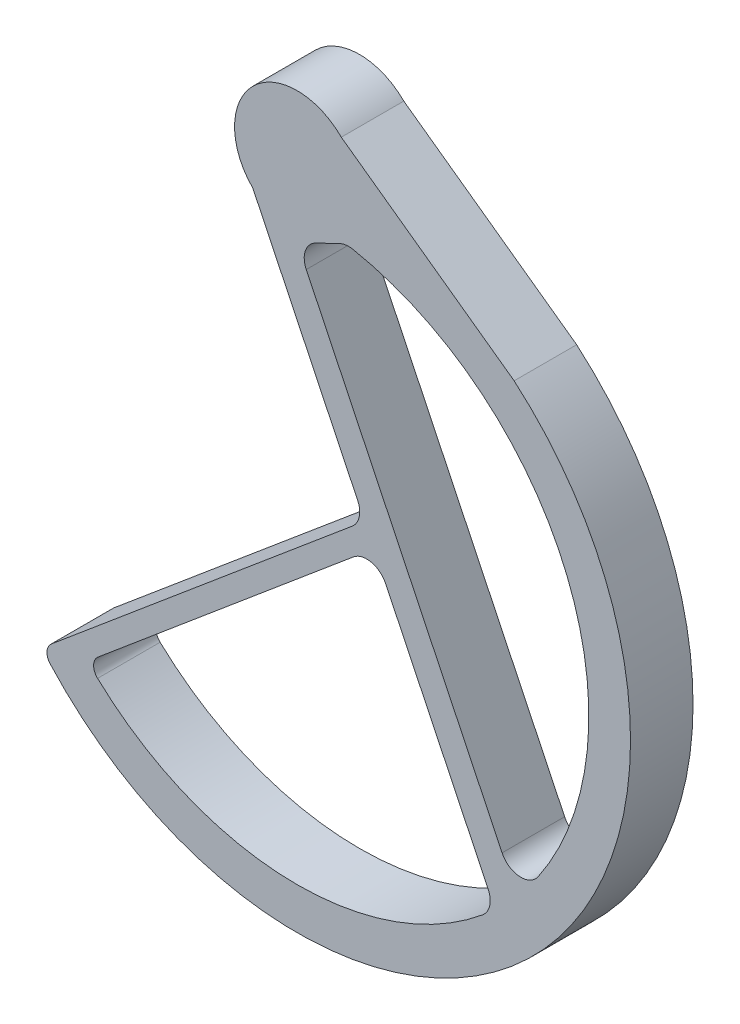
from build123d import *

# Parameters (mm, degrees)
EXTRUDE_1_DEPTH     = 15
CUT_EXTRUDE_START   = -15
CUT_EXTRUDE_1_DEPTH = 15
SKETCH_8_R          = 10
CUT_EXTRUDE_3_DEPTH = 2


with BuildPart() as part:
    # ｽｹｯﾁ4 → ﾎﾞｽ - 押し出し1 (new body)
    with BuildSketch(Plane.XY):
        with BuildLine():
            Line((-53.623111018, -124.995132678), (-58.940636287, -129.45706617))
            ThreePointArc((-58.940636287, -129.45706617), (-60.005384698, -131.552012131), (-59.233530865, -133.771635843))
            ThreePointArc((-59.233530865, -133.771635843), (57.362306223, -135.763481103), (52.076178918, -19.270504783))
            Line((52.076178918, -19.270504783), (10.606601718, 10.606601718))
            ThreePointArc((10.606601718, 10.606601718), (-10.606601718, 10.606601718), (-10.606601718, -10.606601718))
            Line((-10.606601718, -10.606601718), (14.536280154, -62.889638219))
            ThreePointArc((14.536280154, -62.889638219), (14.918089499, -66.109676181), (13.244185189, -68.886809092))
            Line((13.244185189, -68.886809092), (-53.623111018, -124.995132678))
        make_face()
        with BuildLine():
            Line((21.232400696, -76.813798404), (45.844843506, -127.993820346))
            ThreePointArc((45.844843506, -127.993820346), (46.221944165, -131.235480845), (44.518718993, -134.019289696))
            ThreePointArc((44.518718993, -134.019289696), (-2.231208213, -149.964431749), (-47.870174388, -131.072951785))
            ThreePointArc((-47.870174388, -131.072951785), (-48.817477846, -128.802229421), (-47.747678417, -126.586582094))
            Line((-47.747678417, -126.586582094), (13.511229465, -75.151532228))
            ThreePointArc((13.511229465, -75.151532228), (17.77869109, -74.092739753), (21.232400696, -76.813798404))
        make_face(mode=Mode.SUBTRACT)
    extrude(amount=EXTRUDE_1_DEPTH)

    # ｽｹｯﾁ6 → ｶｯﾄ - 押し出し1 (cut)
    with BuildSketch(Plane.XY.offset(15).offset(CUT_EXTRUDE_START)):
        with BuildLine():
            Line((49.189589797, -118.797265215), (2.201751786, -21.089020696))
            ThreePointArc((2.201751786, -21.089020696), (1.989274209, -17.268089629), (4.540836142, -14.416039025))
            Line((4.540836142, -14.416039025), (6.483415605, -13.48185369))
            Line((6.483415605, -13.48185369), (10.219658847, -11.685096486))
            ThreePointArc((10.219658847, -11.685096486), (11.747077013, -11.232198087), (13.339423466, -11.282754846))
            ThreePointArc((13.339423466, -11.282754846), (64.738421392, -53.37413296), (57.826055334, -119.448033215))
            ThreePointArc((57.826055334, -119.448033215), (53.319931874, -121.616182211), (49.189589797, -118.797265215))
        make_face()
    extrude(amount=CUT_EXTRUDE_1_DEPTH, mode=Mode.SUBTRACT)

    # ｽｹｯﾁ8 → ｶｯﾄ - 押し出し3 (cut)
    with BuildSketch(Plane(origin=(0, 0, 0), x_dir=(-1, 0, 0), z_dir=(0, 0, -1))):
        Circle(SKETCH_8_R)
    extrude(amount=-CUT_EXTRUDE_3_DEPTH, mode=Mode.SUBTRACT)


solid = part.part
